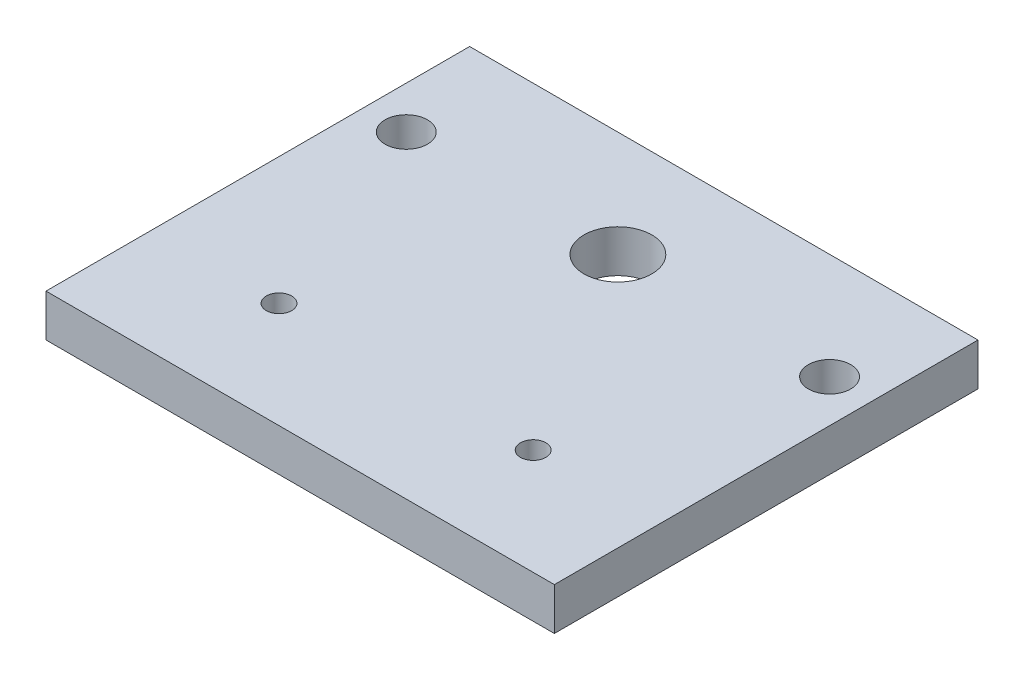
from build123d import *

# Parameters (mm, degrees)
SKETCH1_W           = 60
SKETCH1_H           = 50
SKETCH1_R           = 4
SKETCH1_R_2         = 1.5
SKETCH1_R_3         = 2.5
BOSS_EXTRUDE1_DEPTH = 5


with BuildPart() as part:
    # Sketch1 → Boss-Extrude1 (new body)
    with BuildSketch(Plane(origin=(0, 0, 0), x_dir=(1, 0, 0), z_dir=(0, 1, 0))):
        with Locations((30, -25)):
            Rectangle(SKETCH1_W, SKETCH1_H)
        with Locations(Location((30, -12.5, 0), (0, 0, 270))):
            Circle(SKETCH1_R, mode=Mode.SUBTRACT)
        with Locations(Location((15, -37.5, 0), (0, 0, 270))):
            Circle(SKETCH1_R_2, mode=Mode.SUBTRACT)
        with Locations(Location((45, -37.5, 0), (0, 0, 270))):
            Circle(SKETCH1_R_2, mode=Mode.SUBTRACT)
        with Locations(Location((5.000008253, -12.479686677, 0), (0, 0, 270))):
            Circle(SKETCH1_R_3, mode=Mode.SUBTRACT)
        with Locations(Location((54.999991747, -12.520313323, 0), (0, 0, 270))):
            Circle(SKETCH1_R_3, mode=Mode.SUBTRACT)
    extrude(amount=BOSS_EXTRUDE1_DEPTH)


solid = part.part
